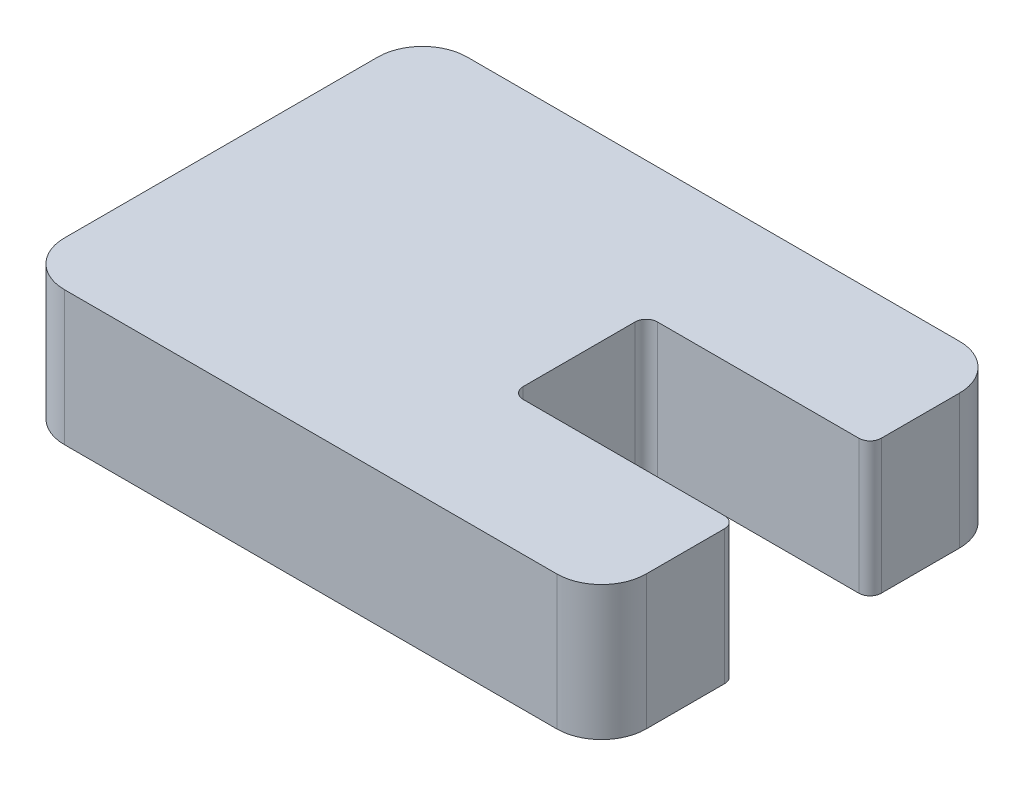
from build123d import *

# Parameters (mm, degrees)
SALIENTE_EXTRUIR1_DEPTH = 3
REDONDEO1_R             = 0.25


with BuildPart() as part:
    # Croquis1 → Saliente-Extruir1 (new body)
    with BuildSketch(Plane(origin=(0, 0, 0), x_dir=(1, 0, 0), z_dir=(0, 1, 0))):
        with BuildLine():
            Line((0, 3.5), (0, -3.5))
            ThreePointArc((0, -3.5), (0.292893219, -4.207106781), (1, -4.5))
            Line((1, -4.5), (12, -4.5))
            ThreePointArc((12, -4.5), (12.707106781, -4.207106781), (13, -3.5))
            Line((13, -3.5), (13, -1.5))
            Line((13, -1.5), (8, -1.5))
            Line((8, -1.5), (8, 1.5))
            Line((8, 1.5), (13, 1.5))
            Line((13, 1.5), (13, 3.5))
            ThreePointArc((13, 3.5), (12.707106781, 4.207106781), (12, 4.5))
            Line((12, 4.5), (1, 4.5))
            ThreePointArc((1, 4.5), (0.292893219, 4.207106781), (0, 3.5))
        make_face()
    extrude(amount=SALIENTE_EXTRUIR1_DEPTH)

    # Redondeo1
    redondeo1_edges = [part.edges().sort_by_distance(p)[0] for p in [
        (13, 1.5, -1.5),
        (8, 1.5, -1.5),
        (8, 1.5, 1.5),
        (13, 1.5, 1.5),
    ]]
    fillet(redondeo1_edges, radius=REDONDEO1_R)


solid = part.part
